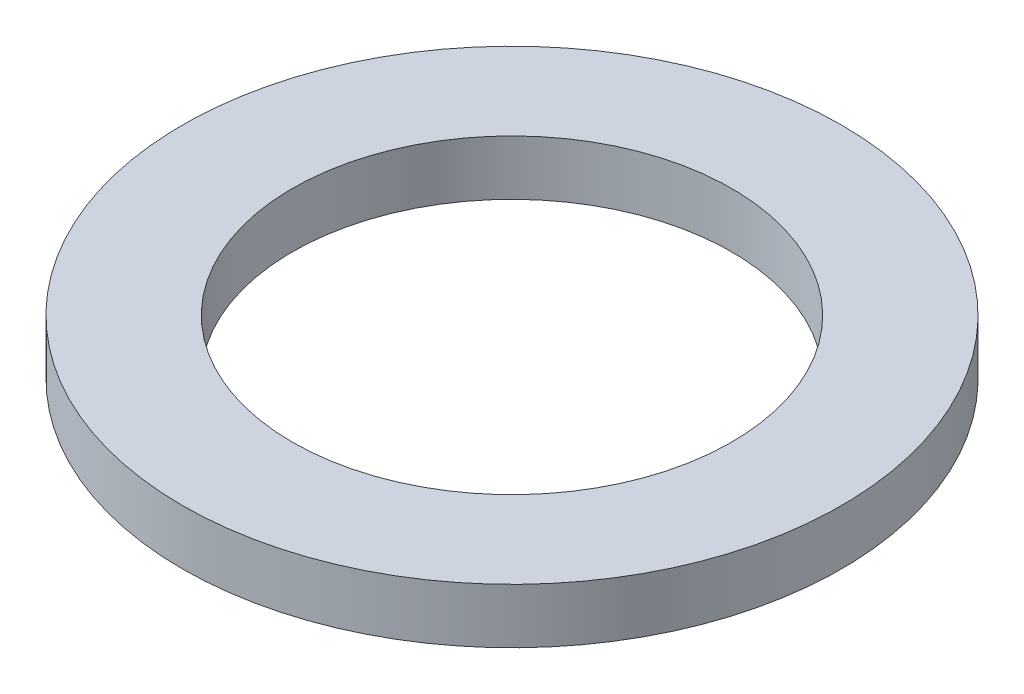
from build123d import *

# Parameters (mm, degrees)
SKETCH1_R           = 30
SKETCH1_R_2         = 20
BOSS_EXTRUDE1_DEPTH = 5


with BuildPart() as part:
    # Sketch1 → Boss-Extrude1 (new body)
    with BuildSketch(Plane(origin=(0, 0, 0), x_dir=(1, 0, 0), z_dir=(0, 1, 0))):
        with Locations(Location((0, 0, 0), (0, 0, 270))):
            Circle(SKETCH1_R)
        with Locations(Location((0, 0, 0), (0, 0, 270))):
            Circle(SKETCH1_R_2, mode=Mode.SUBTRACT)
    extrude(amount=BOSS_EXTRUDE1_DEPTH)


solid = part.part
